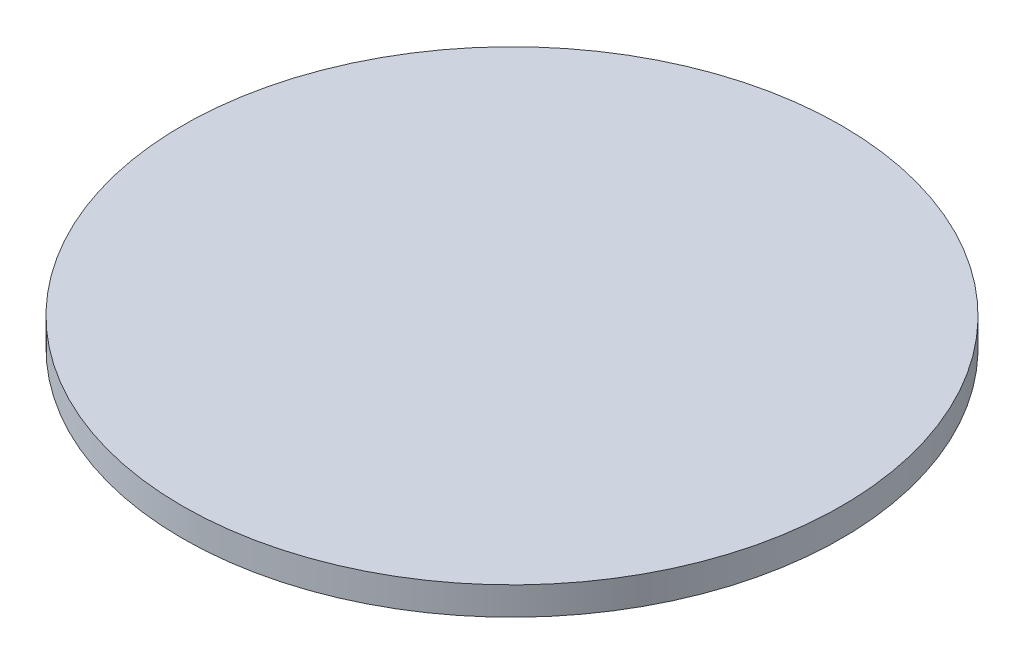
from build123d import *

# Parameters (mm, degrees)
SKETCH1_R           = 149.225
BOSS_EXTRUDE1_DEPTH = 12.7


with BuildPart() as part:
    # Sketch1 → Boss-Extrude1 (new body)
    with BuildSketch(Plane(origin=(0, 0, 0), x_dir=(1, 0, 0), z_dir=(0, 1, 0))):
        with Locations(Location((0, 0, 0), (0, 0, 270))):
            Circle(SKETCH1_R)
    extrude(amount=BOSS_EXTRUDE1_DEPTH)


solid = part.part
